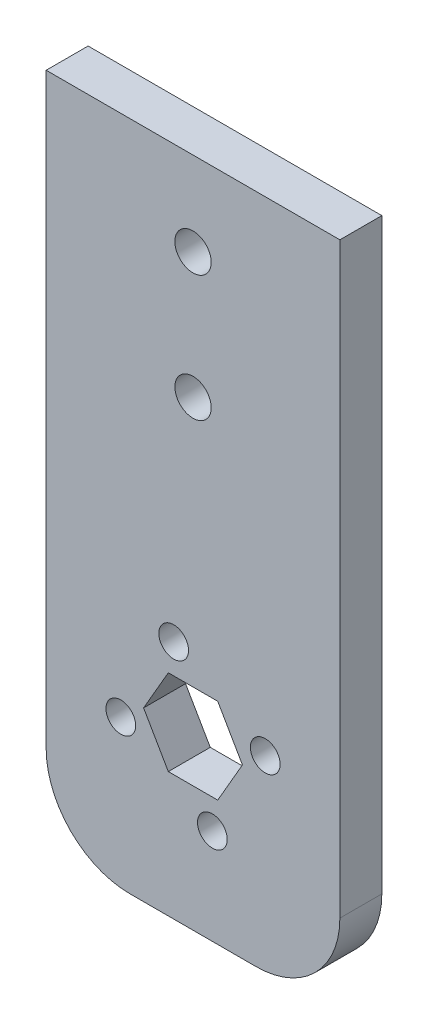
from build123d import *

# Parameters (mm, degrees)
SKETCH1_W            = 44.45
SKETCH1_H            = 101.6
BOSS_EXTRUDE2_DEPTH  = 6.35
FILLET1_R            = 12.7
M5_CLEARANCE_HOLE1_D = 5.5
CUT_EXTRUDE1_DEPTH   = 112.079633597
M4_CLEARANCE_HOLE1_D = 4.5


with BuildPart() as part:
    # Sketch1 → Boss-Extrude2 (new body)
    with BuildSketch(Plane.XY):
        with Locations((-22.225, 50.8)):
            Rectangle(SKETCH1_W, SKETCH1_H)
    extrude(amount=BOSS_EXTRUDE2_DEPTH)

    # Fillet1
    fillet1_edges = [part.edges().sort_by_distance(p)[0] for p in [
        (0, 0, 3.175),
        (-44.45, 0, 3.175),
    ]]
    fillet(fillet1_edges, radius=FILLET1_R)

    # M5 Clearance Hole1 (through all)
    with Locations(Plane(origin=(0, 0, 0), x_dir=(-1, 0, 0), z_dir=(0, 0, -1))):
        with Locations((22.225, 88.9), (22.225, 69.85)):
            Hole(M5_CLEARANCE_HOLE1_D / 2)

    # Sketch14 → Cut-Extrude1 (cut, through all)
    with BuildSketch(Plane.XY.offset(6.35)):
        Polygon((-14.746004613, 25.4), (-18.485502306, 31.877), (-25.964497694, 31.877), (-29.703995387, 25.4), (-25.964497694, 18.923), (-18.485502306, 18.923), align=None)
    extrude(amount=-CUT_EXTRUDE1_DEPTH, mode=Mode.SUBTRACT)

    # M4 Clearance Hole1 (through all)
    with Locations(Plane(origin=(0, 0, 0), x_dir=(-1, 0, 0), z_dir=(0, 0, -1))):
        with Locations((11.29679677, 28.32820323), (25.15320323, 36.32820323), (33.15320323, 22.47179677), (19.29679677, 14.47179677)):
            Hole(M4_CLEARANCE_HOLE1_D / 2)


solid = part.part
